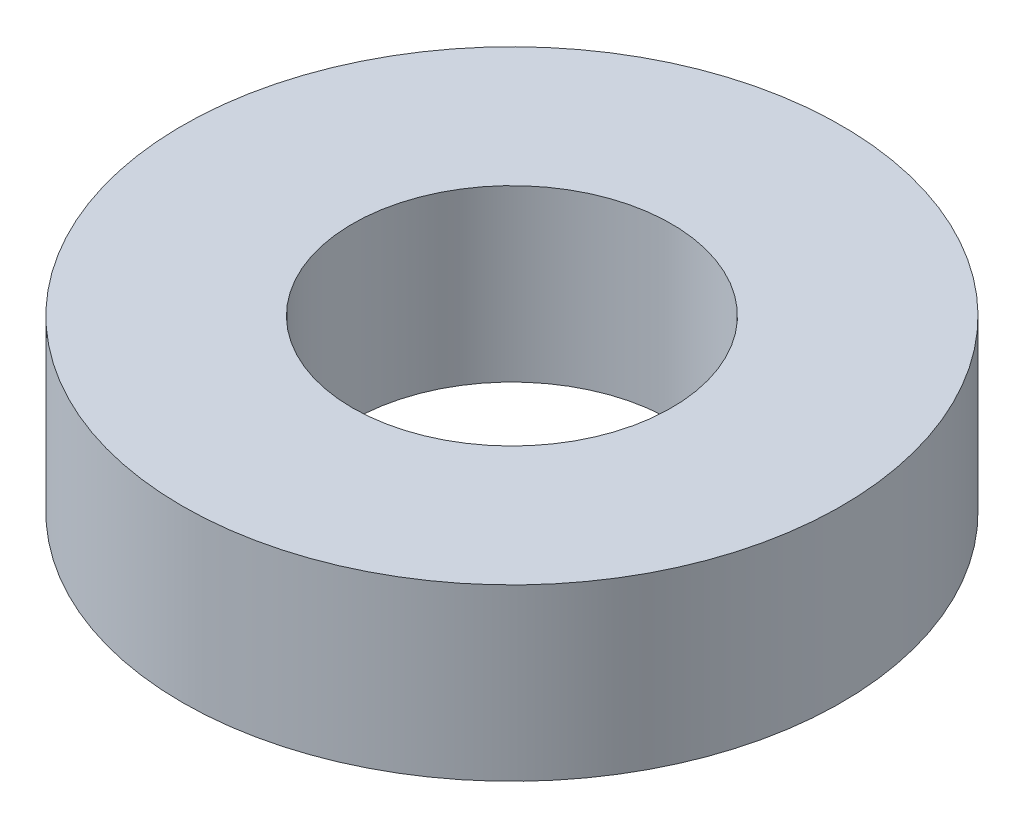
from build123d import *

# Parameters (mm, degrees)
SKETCH1_R           = 31
SKETCH1_R_2         = 15
BOSS_EXTRUDE1_DEPTH = 16


with BuildPart() as part:
    # Sketch1 → Boss-Extrude1 (new body)
    with BuildSketch(Plane(origin=(0, 0, 0), x_dir=(1, 0, 0), z_dir=(0, 1, 0))):
        with Locations(Location((0, 0, 0), (0, 0, 270))):
            Circle(SKETCH1_R)
        with Locations(Location((0, 0, 0), (0, 0, 270))):
            Circle(SKETCH1_R_2, mode=Mode.SUBTRACT)
    extrude(amount=BOSS_EXTRUDE1_DEPTH)


solid = part.part
